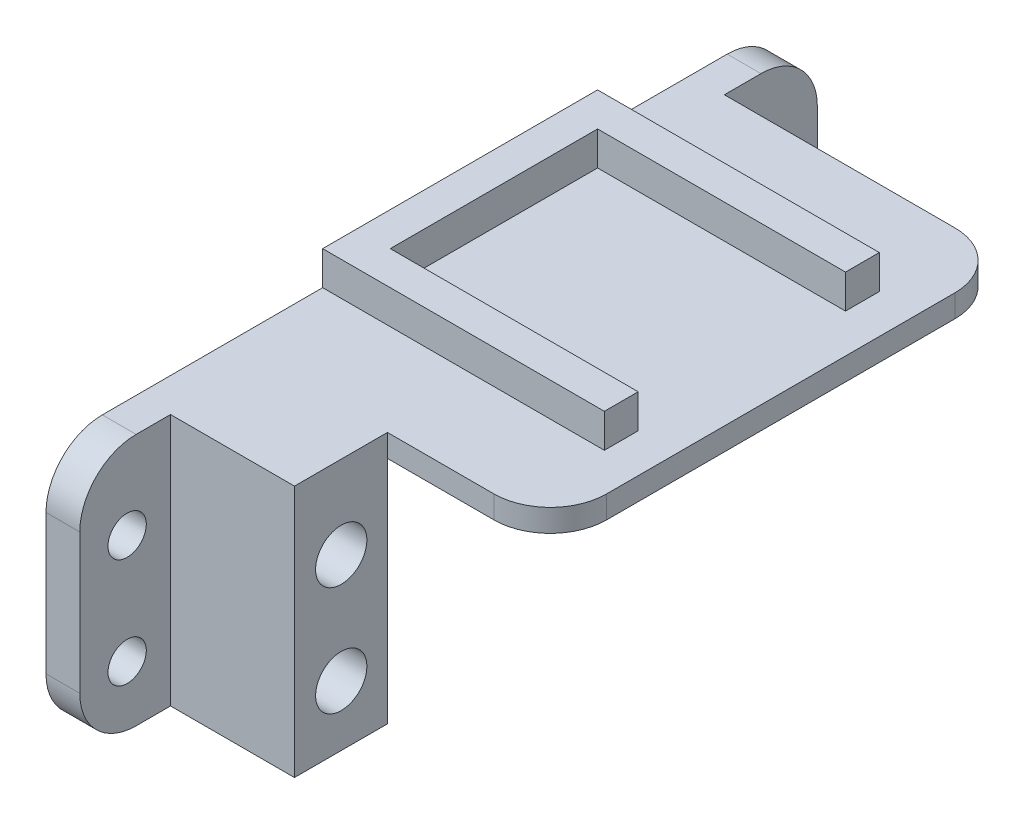
from build123d import *

# Parameters (mm, degrees)
BOSS_EXTRUDE1_DEPTH = 2
SKETCH1_3_W         = 14
SKETCH1_3_H         = 8.25
SKETCH1_3_W_2       = 3
BOSS_EXTRUDE2_DEPTH = 20.4
BOSS_EXTRUDE4_START = -6.075
SKETCH5_W           = 8.05
SKETCH5_H           = 22.4
BOSS_EXTRUDE4_DEPTH = 3
CUT_EXTRUDE1_START  = -6.075
SKETCH2_R           = 1.7
SKETCH2_R_2         = 2.275
CUT_EXTRUDE1_DEPTH  = 54.691836571
FILLET1_R           = 5
SKETCH6_W           = 3
SKETCH6_H           = 18.4
BOSS_EXTRUDE5_DEPTH = 5


with BuildPart() as part:
    # Sketch1 → Boss-Extrude1 (new body)
    with BuildSketch(Plane(origin=(0, 0, 0), x_dir=(1, 0, 0), z_dir=(0, 1, 0))):
        Polygon((22.375, -20.45), (22.375, 20.45), (-3.075, 20.45), (-3.075, 28.7), (-6.075, 28.7), (-6.075, -28.7), (7.925, -28.7), (7.925, -20.45), align=None)
    extrude(amount=BOSS_EXTRUDE1_DEPTH)

    # Sketch1<3> → Boss-Extrude2 (add)
    with BuildSketch(Plane(origin=(0, 0, 0), x_dir=(1, 0, 0), z_dir=(0, 1, 0))):
        with Locations((0.925, -24.575)):
            Rectangle(SKETCH1_3_W, SKETCH1_3_H)
        with Locations((-4.575, 24.575)):
            Rectangle(SKETCH1_3_W_2, SKETCH1_3_H)
    extrude(amount=-BOSS_EXTRUDE2_DEPTH)

    # Sketch5 → Boss-Extrude4 (add)
    with BuildSketch(Plane(origin=(0, 0, 0), x_dir=(0, 0, -1), z_dir=(1, 0, 0)).offset(BOSS_EXTRUDE4_START)):
        with Locations((-32.725, -9.2)):
            Rectangle(SKETCH5_W, SKETCH5_H)
    extrude(amount=BOSS_EXTRUDE4_DEPTH)

    # Sketch2 → Cut-Extrude1 (cut, through all)
    with BuildSketch(Plane(origin=(0, 0, 0), x_dir=(0, 0, -1), z_dir=(1, 0, 0)).offset(CUT_EXTRUDE1_START)):
        with Locations(Location((24.55, -15.05, 0), (0, 0, 180))):
            Circle(SKETCH2_R)
        with Locations(Location((-24.55, -15.05, 0), (0, 0, 180))):
            Circle(SKETCH2_R_2)
        with Locations(Location((-24.55, -5.35, 0), (0, 0, 180))):
            Circle(SKETCH2_R_2)
        with Locations(Location((24.55, -5.35, 0), (0, 0, 180))):
            Circle(SKETCH2_R)
        with Locations(Location((-32.55, -5.35, 0), (0, 0, 180))):
            Circle(SKETCH2_R)
        with Locations(Location((-32.55, -15.05, 0), (0, 0, 180))):
            Circle(SKETCH2_R)
    extrude(amount=CUT_EXTRUDE1_DEPTH, mode=Mode.SUBTRACT)

    # Fillet1
    fillet1_edges = [part.edges().sort_by_distance(p)[0] for p in [
        (22.375, 1, -20.45),
        (22.375, 1, 20.45),
        (-4.575, -20.4, -28.7),
        (-4.575, 2, -28.7),
        (-4.575, 2, 36.75),
        (-4.575, -20.4, 36.75),
    ]]
    fillet(fillet1_edges, radius=FILLET1_R)

    # Sketch6 → Boss-Extrude5 (add)
    with BuildSketch(Plane(origin=(0, 0, 0), x_dir=(1, 0, 0), z_dir=(0, 1, 0))):
        Polygon((-6.075, 12.2), (-6.075, 9.2), (-3.075, 9.2), (18.925, 9.2), (18.925, 12.2), align=None)
        with Locations((-4.575, 0)):
            Rectangle(SKETCH6_W, SKETCH6_H)
        Polygon((-3.075, -9.2), (-6.075, -9.2), (-6.075, -12.2), (18.925, -12.2), (18.925, -9.2), align=None)
    extrude(amount=BOSS_EXTRUDE5_DEPTH)


solid = part.part
